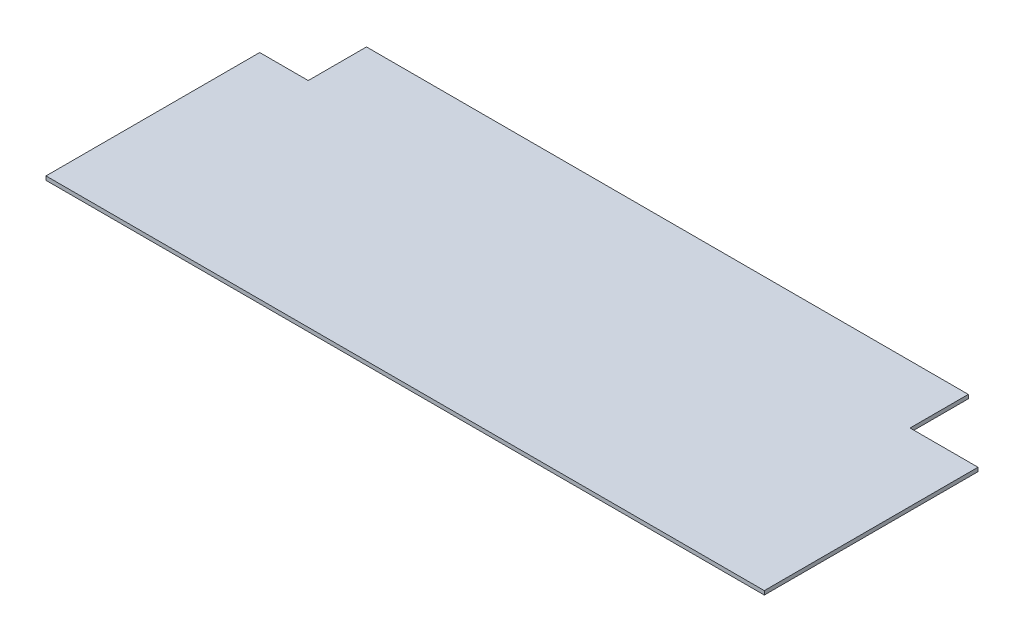
from build123d import *

# Parameters (mm, degrees)
BOSS_EXTRUDE1_DEPTH = 2.54


with BuildPart() as part:
    # Sketch1 → Boss-Extrude1 (new body)
    with BuildSketch(Plane(origin=(0, 0, 0), x_dir=(1, 0, 0), z_dir=(0, 1, 0))):
        Polygon((-124.27279724, 140.311267915), (-124.27279724, 0.515267915), (345.628602808, 0.515267915), (345.628602808, 140.311267915), (301.178602808, 140.311267915), (301.178602808, 178.411267915), (-92.52279724, 178.411267915), (-92.52279724, 140.311267915), align=None)
    extrude(amount=BOSS_EXTRUDE1_DEPTH)


solid = part.part
